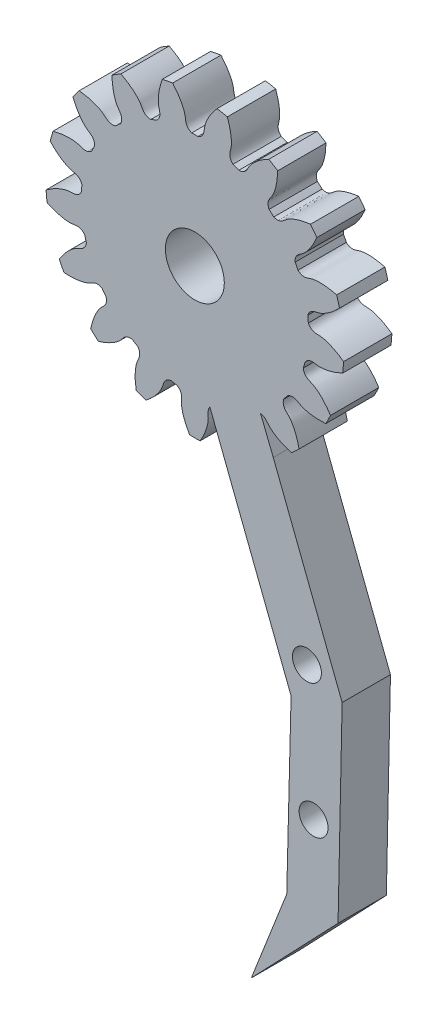
from build123d import *

# Parameters (mm, degrees)
SKETCH_1_R               = 15.4185
EXTRUDE_1_DEPTH          = 5
CUT_EXTRUDE_1_DEPTH      = 23.370969682
PATTERN_CIRCULAR_1_COUNT = 17
SKETCH_4_R               = 3.05
CUT_EXTRUDE_2_DEPTH      = 10
EXTRUDE_2_DEPTH          = 5
SKETCH_15_R              = 1.5
CUT_EXTRUDE_3_DEPTH      = 10


with BuildPart() as part:
    # 草图1 → 凸台-拉伸1 (new body)
    with BuildSketch(Plane.XY):
        Circle(SKETCH_1_R)
    extrude(amount=EXTRUDE_1_DEPTH)

    # 草图2 → 切除-拉伸1 (cut, through all)
    with BuildSketch(Plane.XY):
        with BuildLine():
            ThreePointArc((0.327348952, 11.762195723), (0, 11.76675), (-0.327348952, 11.762195723))
            add(Edge.make_bspline(
                [(-0.327348952, 11.762195723), (-1.019048819, 12.05048614), (-0.918935099, 12.586062159), (-1.035969996, 13.089209576), (-1.046795617, 13.131937416), (-1.05984903, 13.179440546), (-1.075319607, 13.231645995), (-1.093401755, 13.288473767), (-1.114285386, 13.349838413), (-1.138158687, 13.415648618), (-1.165207064, 13.485807407), (-1.195613266, 13.560212171), (-1.229557151, 13.63875475), (-1.26721556, 13.721321501), (-1.308762166, 13.807793383), (-1.354367329, 13.898046034), (-1.404197952, 13.991949858), (-1.458417341, 14.089370118), (-1.517185067, 14.19016702), (-1.58065683, 14.294195818), (-1.648984323, 14.401306911), (-1.722315103, 14.511345943), (-1.800792459, 14.624153912), (-1.884555287, 14.739567282), (-1.97373797, 14.857418089), (-2.068470251, 14.977534064), (-2.168877117, 15.099738747), (-2.275078688, 15.223851613), (-2.387190097, 15.349688191), (-2.505321389, 15.477060201), (-2.62957741, 15.605775673), (-2.760057705, 15.73563909), (-2.896856419, 15.866451519), (-3.040062202, 15.998010749), (-3.189758115, 16.130111435), (-3.346021539, 16.262545238), (-3.508924092, 16.395100973), (-3.678531546, 16.527564754), (-3.854903748, 16.659720146), (-4.038094542, 16.791348319), (-4.22815171, 16.922228195), (-4.425116859, 17.052136614), (-4.699918513, 17.225597756), (-4.912134312, 17.350723651), (-5.056693187, 17.432187129)],
                knots=[0, 0, 0, 0, 0.193882922, 0.199023975, 0.204850501, 0.211362501, 0.218559975, 0.226442923, 0.235011345, 0.24426524, 0.254204608, 0.264829451, 0.276139767, 0.288135557, 0.300816821, 0.314183558, 0.328235769, 0.342973453, 0.358396612, 0.374505244, 0.39129935, 0.408778929, 0.426943982, 0.445794509, 0.46533051, 0.485551984, 0.506458932, 0.528051354, 0.550329249, 0.573292619, 0.596941461, 0.621275778, 0.646295568, 0.672000832, 0.69839157, 0.725467781, 0.753229466, 0.781676625, 0.810809257, 0.840627364, 0.871130943, 0.902319997, 0.934194524, 1, 1, 1, 1], degree=3))
            ThreePointArc((-5.056693187, 17.432187129), (0, 18.150793208), (5.056693187, 17.432187129))
            add(Edge.make_bspline(
                [(0.327348952, 11.762195723), (1.019048819, 12.05048614), (0.918935099, 12.586062159), (1.035969996, 13.089209576), (1.046795617, 13.131937416), (1.05984903, 13.179440546), (1.075319607, 13.231645995), (1.093401755, 13.288473767), (1.114285386, 13.349838413), (1.138158687, 13.415648618), (1.165207064, 13.485807407), (1.195613266, 13.560212171), (1.229557151, 13.63875475), (1.26721556, 13.721321501), (1.308762166, 13.807793383), (1.354367329, 13.898046034), (1.404197952, 13.991949858), (1.458417341, 14.089370118), (1.517185067, 14.19016702), (1.58065683, 14.294195818), (1.648984323, 14.401306911), (1.722315103, 14.511345943), (1.800792459, 14.624153912), (1.884555287, 14.739567282), (1.97373797, 14.857418089), (2.068470251, 14.977534064), (2.168877117, 15.099738747), (2.275078688, 15.223851613), (2.387190097, 15.349688191), (2.505321389, 15.477060201), (2.62957741, 15.605775673), (2.760057705, 15.73563909), (2.896856419, 15.866451519), (3.040062202, 15.998010749), (3.189758115, 16.130111435), (3.346021539, 16.262545238), (3.508924092, 16.395100973), (3.678531546, 16.527564754), (3.854903748, 16.659720146), (4.038094542, 16.791348319), (4.22815171, 16.922228195), (4.425116859, 17.052136614), (4.699918513, 17.225597756), (4.912134312, 17.350723651), (5.056693187, 17.432187129)],
                knots=[0, 0, 0, 0, 0.193882922, 0.199023975, 0.204850501, 0.211362501, 0.218559975, 0.226442923, 0.235011345, 0.24426524, 0.254204608, 0.264829451, 0.276139767, 0.288135557, 0.300816821, 0.314183558, 0.328235769, 0.342973453, 0.358396612, 0.374505244, 0.39129935, 0.408778929, 0.426943982, 0.445794509, 0.46533051, 0.485551984, 0.506458932, 0.528051354, 0.550329249, 0.573292619, 0.596941461, 0.621275778, 0.646295568, 0.672000832, 0.69839157, 0.725467781, 0.753229466, 0.781676625, 0.810809257, 0.840627364, 0.871130943, 0.902319997, 0.934194524, 1, 1, 1, 1], degree=3))
        make_face()
    cut_extrude_1 = extrude(amount=CUT_EXTRUDE_1_DEPTH, mode=Mode.SUBTRACT)

    # 阵列(圆周)1: 切除-拉伸1 ×17 about axis
    pattern_circular_1_axis = Axis((0, 0, 5), (0, 0, -1))
    for i in range(1, PATTERN_CIRCULAR_1_COUNT):
        add(cut_extrude_1.rotate(pattern_circular_1_axis, i * 360 / PATTERN_CIRCULAR_1_COUNT), mode=Mode.SUBTRACT)

    # 草图4 → 切除-拉伸2 (cut)
    with BuildSketch(Plane.XY.offset(5)):
        Circle(SKETCH_4_R)
    extrude(amount=-CUT_EXTRUDE_2_DEPTH, mode=Mode.SUBTRACT)

    # 草图11 → 凸台-拉伸2 (add)
    with BuildSketch(Plane(origin=(0, 0, 0), x_dir=(-1, 0, 0), z_dir=(0, 0, -1))):
        Polygon((-8.116794303, -13.109072907), (-5.649519948, -6.938188586), (-0.499181806, -8.933440212), (-0.432524695, -8.959263314), (-2.83314194, -15.155970737), (-9.87891064, -33.34319625), (-9.960141543, -33.55287738), (-9.510186791, -51.547252632), (-5.838944168, -60.899588817), (-14.820931177, -51.501508727), (-15.243793906, -31.505979549), align=None)
    extrude(amount=-EXTRUDE_2_DEPTH)

    # 草图15 → 切除-拉伸3 (cut)
    with BuildSketch(Plane(origin=(0, 0, 0), x_dir=(-1, 0, 0), z_dir=(0, 0, -1))):
        with Locations((-11.59739649, -29.945028807)):
            Circle(SKETCH_15_R)
        with Locations((-12.287845126, -43.478206879)):
            Circle(SKETCH_15_R)
    extrude(amount=-CUT_EXTRUDE_3_DEPTH, mode=Mode.SUBTRACT)


solid = part.part
